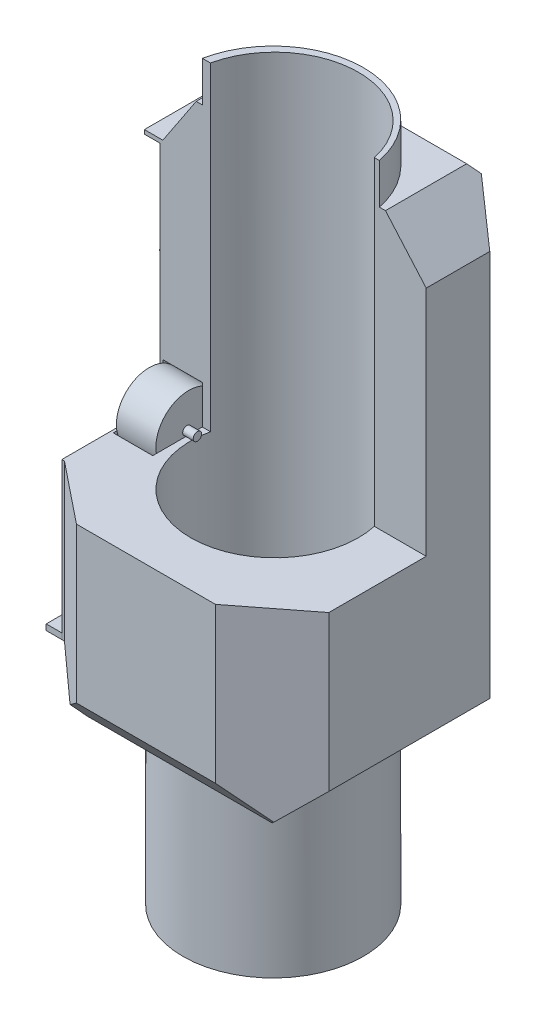
from build123d import *

# Parameters (mm, degrees)
SKETCH1_W            = 100
SKETCH1_H            = 100
BOSS_EXTRUDE1_DEPTH  = 180
SKETCH2_R            = 34.257790197
BOSS_EXTRUDE2_DEPTH  = 350
SKETCH3_W            = 152.006357392
SKETCH3_H            = 282.452416457
CUT_EXTRUDE2_DEPTH   = 400
CUT_EXTRUDE3_DEPTH   = 400
CUT_EXTRUDE4_DEPTH   = 400
CUT_EXTRUDE5_DEPTH   = 400
SKETCH7_W            = 160.159381639
SKETCH7_H            = 147.362276113
CUT_EXTRUDE6_DEPTH   = 400
SKETCH8_W            = 147.310744502
SKETCH8_H            = 162.038906966
CUT_EXTRUDE7_DEPTH   = 400
SKETCH9_R            = 31.847293423
CUT_EXTRUDE8_DEPTH   = 400
SKETCH10_W           = 140.220962397
SKETCH10_H           = 212.033531124
CUT_EXTRUDE9_DEPTH   = 400
SKETCH11_R           = 13.603137886
CUT_EXTRUDE11_DEPTH  = 15
SKETCH12_R           = 12.495422516
BOSS_EXTRUDE3_DEPTH  = 15
SKETCH13_R           = 1.594865099
BOSS_EXTRUDE4_DEPTH  = 4
SKETCH14_W           = 100.74862993
SKETCH14_H           = 110.555003588
CUT_EXTRUDE13_DEPTH  = 400
BOSS_EXTRUDE5_DEPTH  = 1
SKETCH16_W           = 24.504230724
SKETCH16_H           = 30.458347221
BOSS_EXTRUDE6_DEPTH  = 5
SKETCH17_W           = 18.669530869
SKETCH17_H           = 22.4027039
BOSS_EXTRUDE7_DEPTH  = 1
SKETCH18_W           = 4.907623399
SKETCH18_H           = 5.170746831
SKETCH18_W_2         = 3.981473695
SKETCH18_H_2         = 5.451349552
BOSS_EXTRUDE8_DEPTH  = 1
BOSS_EXTRUDE9_DEPTH  = 1
SKETCH21_W           = 16.281298494
SKETCH21_H           = 30.70477752
BOSS_EXTRUDE10_DEPTH = 5
SKETCH22_W           = 0.561666562
SKETCH22_H           = 0.603858724
SKETCH22_W_2         = 0.53443704
SKETCH22_W_3         = 0.536755884
SKETCH22_H_2         = 0.595744993
SKETCH22_W_4         = 0.555081497
SKETCH22_H_3         = 0.603543747
SKETCH22_H_4         = 0.606016701
SKETCH22_W_5         = 0.51195437
BOSS_EXTRUDE11_DEPTH = 1
BOSS_EXTRUDE12_DEPTH = 6
SKETCH25_W           = 2.05187696
SKETCH25_H           = 1.431834862
SKETCH25_W_2         = 1.796011721
SKETCH25_H_2         = 1.401423583
SKETCH25_W_3         = 2.236836814
SKETCH25_H_3         = 1.629424689
SKETCH25_W_4         = 3.100041403
SKETCH25_H_4         = 2.495375298
BOSS_EXTRUDE14_DEPTH = 1
SKETCH26_R           = 0.573723192
SKETCH26_R_2         = 0.465712851
SKETCH26_R_3         = 0.493763185
SKETCH26_R_4         = 0.521232976
SKETCH26_R_5         = 1.279348583
BOSS_EXTRUDE15_DEPTH = 3


with BuildPart() as part:
    # Sketch1 → Boss-Extrude1 (new body)
    with BuildSketch(Plane(origin=(0, 0, 0), x_dir=(1, 0, 0), z_dir=(0, 1, 0))):
        with Locations((-50, 50)):
            Rectangle(SKETCH1_W, SKETCH1_H)
    extrude(amount=BOSS_EXTRUDE1_DEPTH)

    # Sketch2 → Boss-Extrude2 (add, symmetric)
    with BuildSketch(Plane(origin=(0, 180, 0), x_dir=(1, 0, 0), z_dir=(0, 1, 0))):
        with Locations(Location((-51.377291833, 49.076536384, 0), (0, 0, 270))):
            Circle(SKETCH2_R)
    extrude(amount=BOSS_EXTRUDE2_DEPTH, both=True)

    # Sketch3 → Cut-Extrude2 (cut)
    with BuildSketch(Plane(origin=(0, 0, 0), x_dir=(0, 0, -1), z_dir=(1, 0, 0))):
        with Locations((57.419900112, 502.274302507)):
            Rectangle(SKETCH3_W, SKETCH3_H)
    extrude(amount=-CUT_EXTRUDE2_DEPTH, mode=Mode.SUBTRACT)

    # Sketch4 → Cut-Extrude3 (cut)
    with BuildSketch(Plane(origin=(0, 0, 0), x_dir=(0, 0, -1), z_dir=(1, 0, 0))):
        Polygon((12.981970869, 0), (-8.994244796, 25.828096003), (-18.564506014, -15.259465835), align=None)
        Polygon((85.072517936, -1.448103984), (109.237639161, 19.113145112), (115.920034239, -3.267382694), align=None)
        Polygon((12.981970869, 180), (-8.994244796, 148.537596011), (-15.418178585, 193.219274892), align=None)
        Polygon((85.072517936, 181.854312784), (103.841225373, 159.795920888), (106.132549481, 198.647393934), align=None)
    extrude(amount=-CUT_EXTRUDE3_DEPTH, mode=Mode.SUBTRACT)

    # Sketch5 → Cut-Extrude4 (cut)
    with BuildSketch(Plane.XY):
        Polygon((-85.623287335, 0), (-106.370377984, 21.426392531), (-122.288861874, 3.209259887), (-93.526345261, -19.884701759), align=None)
        Polygon((-15.694988751, 0), (0, 15.257385304), (12.122677088, 15.257385304), (10.563067769, -19.884701759), align=None)
        Polygon((-87.166490339, 180.248071029), (-106.370377984, 151.29108453), (-117.705469457, 200.501115102), align=None)
        Polygon((-15.694988751, 180.248071029), (7.833767065, 153.279557508), (0, 193.941208308), align=None)
    extrude(amount=-CUT_EXTRUDE4_DEPTH, mode=Mode.SUBTRACT)

    # Sketch6 → Cut-Extrude5 (cut)
    with BuildSketch(Plane(origin=(0, 180, 0), x_dir=(1, 0, 0), z_dir=(0, 1, 0))):
        Polygon((-112.386997555, 28.400400964), (-64.261264503, -10.212759359), (-84.406366528, -15.51192827), (-124.649689542, -15.51192827), align=None)
        Polygon((-97.065537028, 135.861756084), (-119.37552445, 77.792688888), (-118.043343626, 64.347606737), (-66.428694172, 110.575168787), align=None)
        Polygon((-24.69640689, -21.815840769), (11.092108798, -8.97361337), (17.428316417, 32.393768119), (-38.531576846, -11.139157378), align=None)
        Polygon((-17.445484601, 140.804394854), (35.417473102, 107.262520599), (9.305452855, 72.996438725), (-31.724385352, 103.625272537), align=None)
    extrude(amount=-CUT_EXTRUDE5_DEPTH, mode=Mode.SUBTRACT)

    # Sketch7 → Cut-Extrude6 (cut)
    with BuildSketch(Plane.XY):
        with Locations((-66.123258915, -136.36252694)):
            Rectangle(SKETCH7_W, SKETCH7_H)
    extrude(amount=-CUT_EXTRUDE6_DEPTH, mode=Mode.SUBTRACT)

    # Sketch8 → Cut-Extrude7 (cut)
    with BuildSketch(Plane.XY):
        with Locations((-53.541153336, 332.448287589)):
            Rectangle(SKETCH8_W, SKETCH8_H)
    extrude(amount=-CUT_EXTRUDE7_DEPTH, mode=Mode.SUBTRACT)

    # Sketch9 → Cut-Extrude8 (cut)
    with BuildSketch(Plane(origin=(0, 251.428834106, 0), x_dir=(1, 0, 0), z_dir=(0, 1, 0))):
        with Locations(Location((-50.808993157, 49.032036374, 0), (0, 0, 270))):
            Circle(SKETCH9_R)
    extrude(amount=-CUT_EXTRUDE8_DEPTH, mode=Mode.SUBTRACT)

    # Sketch10 → Cut-Extrude9 (cut)
    with BuildSketch(Plane.ZY.offset(100)):
        with Locations((14.299084536, 180.100625535)):
            Rectangle(SKETCH10_W, SKETCH10_H)
    extrude(amount=-CUT_EXTRUDE9_DEPTH, mode=Mode.SUBTRACT)

    # Sketch11 → Cut-Extrude11 (cut)
    with BuildSketch(Plane.ZY.offset(100)):
        with Locations((-50.413251954, 76.264646142)):
            Circle(SKETCH11_R)
    extrude(amount=-CUT_EXTRUDE11_DEPTH, mode=Mode.SUBTRACT)

    # Sketch12 → Boss-Extrude3 (add)
    with BuildSketch(Plane.ZY.offset(85)):
        with Locations(Location((-50.658800768, 76.222522328, 0), (0, 0, 114.353089558))):
            Circle(SKETCH12_R)
    extrude(amount=BOSS_EXTRUDE3_DEPTH)

    # Sketch13 → Boss-Extrude4 (add)
    with BuildSketch(Plane(origin=(-85, 0, 0), x_dir=(0, 0, -1), z_dir=(1, 0, 0))):
        with Locations(Location((49.945205578, 75.944780088, 0), (0, 0, 180))):
            Circle(SKETCH13_R)
    extrude(amount=BOSS_EXTRUDE4_DEPTH)

    # Sketch14 → Cut-Extrude13 (cut)
    with BuildSketch(Plane.ZY.offset(100)):
        with Locations((-65.350029467, 250.603414818)):
            Rectangle(SKETCH14_W, SKETCH14_H)
    extrude(amount=-CUT_EXTRUDE13_DEPTH, mode=Mode.SUBTRACT)

    # Sketch15 → Boss-Extrude5 (add)
    with BuildSketch(Plane.ZY.offset(100)):
        Polygon((-18.461827727, 14.847435435), (-80.507743362, 14.847435435), (-80.507743362, 160.896793159), (-55.811396663, 160.896793159), (-55.811396663, 74.083859973), (-18.461827727, 74.083859973), align=None)
    extrude(amount=BOSS_EXTRUDE5_DEPTH)

    # Sketch16 → Boss-Extrude6 (add)
    with BuildSketch(Plane.ZY.offset(101)):
        with Locations((-39.275145749, 45.136437142)):
            Rectangle(SKETCH16_W, SKETCH16_H)
    extrude(amount=BOSS_EXTRUDE6_DEPTH)

    # Sketch17 → Boss-Extrude7 (add)
    with BuildSketch(Plane.ZY.offset(101)):
        with Locations((-67.04663872, 130.409241603)):
            Rectangle(SKETCH17_W, SKETCH17_H)
    extrude(amount=BOSS_EXTRUDE7_DEPTH)

    # Sketch18 → Boss-Extrude8 (add)
    with BuildSketch(Plane.ZY.offset(102)):
        with Locations((-71.625108618, 130.213401885)):
            Rectangle(SKETCH18_W, SKETCH18_H)
        with Locations((-62.297675883, 129.867186512)):
            Rectangle(SKETCH18_W_2, SKETCH18_H_2)
    extrude(amount=BOSS_EXTRUDE8_DEPTH)

    # Sketch19 → Boss-Extrude9 (add)
    with BuildSketch(Plane.ZY.offset(102)):
        Polygon((-66.976455081, 134.868836652), (-73.7929295, 134.868836652), (-73.7929295, 134.108269479), (-74.571872104, 134.108269479), (-74.571872104, 140.512729543), (-73.7929295, 140.512729543), (-72.165965418, 140.512729543), (-72.233411796, 137.421948277), (-71.48458153, 137.421948277), (-71.410861795, 140.512729543), (-69.158339735, 140.504865112), (-69.158339735, 137.421948277), (-68.22174926, 137.421948277), (-68.22174926, 140.567922793), (-65.426885805, 140.567922793), (-65.515241968, 137.446210948), (-64.714122339, 137.446210948), (-64.714122339, 140.567922793), (-62.410871788, 140.567922793), (-62.410871788, 137.210126003), (-61.403493639, 137.210126003), (-61.403493639, 140.631129361), (-58.889974549, 140.631129361), (-58.889974549, 136.595539338), (-59.698319644, 136.595539338), (-59.698319644, 139.99489006), (-60.695848378, 139.984078324), (-60.695848378, 136.667717235), (-63.090112056, 136.667717235), (-63.090112056, 139.979723883), (-64.00479018, 139.979723883), (-64.00479018, 136.667717235), (-66.334605538, 136.667717235), (-66.334605538, 139.902697072), (-67.48995239, 139.902697072), (-67.48995239, 136.667717235), (-70.008746759, 136.667717235), (-70.008746759, 139.902697072), (-70.709698815, 139.902697072), (-70.783897489, 136.693128041), (-72.921241048, 136.693128041), (-72.921241048, 139.545601992), (-73.7929295, 139.545601992), (-73.7929295, 135.423339258), (-66.976455081, 135.49721976), align=None)
    extrude(amount=BOSS_EXTRUDE9_DEPTH)

    # Sketch21 → Boss-Extrude10 (add)
    with BuildSketch(Plane.ZY.offset(101)):
        with Locations((-60.112791098, 44.859291254)):
            Rectangle(SKETCH21_W, SKETCH21_H)
    extrude(amount=BOSS_EXTRUDE10_DEPTH)

    # Sketch22 → Boss-Extrude11 (add)
    with BuildSketch(Plane.ZY.offset(102)):
        with Locations((-60.80943011, 132.899150377)):
            Rectangle(SKETCH22_W, SKETCH22_H)
        with Locations((-61.69225831, 132.899150377)):
            Rectangle(SKETCH22_W_2, SKETCH22_H)
        with Locations((-62.62493976, 132.903207243)):
            Rectangle(SKETCH22_W_3, SKETCH22_H_2)
        with Locations((-63.54978292, 132.899150377)):
            Rectangle(SKETCH22_W_4, SKETCH22_H)
        with Locations((-60.80943011, 126.809637752)):
            Rectangle(SKETCH22_W, SKETCH22_H_3)
        with Locations((-61.69225831, 126.810874229)):
            Rectangle(SKETCH22_W_2, SKETCH22_H_4)
        with Locations((-62.612539003, 126.810874229)):
            Rectangle(SKETCH22_W_5, SKETCH22_H_4)
        with Locations((-63.54978292, 126.810874229)):
            Rectangle(SKETCH22_W_4, SKETCH22_H_4)
    extrude(amount=BOSS_EXTRUDE11_DEPTH)

    # Sketch23 → Boss-Extrude12 (add)
    with BuildSketch(Plane.ZY.offset(101)):
        Polygon((-18.537813866, 14.791366127), (-79.213766301, 14.791366127), (-80.507051433, 14.791366127), (-80.507051433, 159.371320923), (-80.507051433, 160.896793159), (-55.811396663, 160.896793159), (-55.811396663, 159.371320923), (-79.213766301, 159.371320923), (-79.213766301, 17.002342126), (-18.537813866, 17.002342126), align=None)
    extrude(amount=BOSS_EXTRUDE12_DEPTH)

    # Sketch25 → Boss-Extrude14 (add)
    with BuildSketch(Plane.ZY.offset(102)):
        with Locations((-61.129787429, 123.818208842)):
            Rectangle(SKETCH25_W, SKETCH25_H)
        with Locations((-65.19439703, 123.964756725)):
            Rectangle(SKETCH25_W_2, SKETCH25_H_2)
        with Locations((-68.910775783, 124.164887859)):
            Rectangle(SKETCH25_W_3, SKETCH25_H_3)
        with Locations((-66.785980271, 133.389843397)):
            Rectangle(SKETCH25_W_4, SKETCH25_H_4)
    extrude(amount=BOSS_EXTRUDE14_DEPTH)

    # Sketch26 → Boss-Extrude15 (add)
    with BuildSketch(Plane.ZY.offset(102)):
        with Locations(Location((-60.110646134, 120.378030712, 0), (0, 0, 180))):
            Circle(SKETCH26_R)
        with Locations(Location((-62.678722835, 120.378030712, 0), (0, 0, 180))):
            Circle(SKETCH26_R_2)
        with Locations(Location((-64.743607979, 120.378030712, 0), (0, 0, 180))):
            Circle(SKETCH26_R_3)
        with Locations(Location((-66.814452943, 120.378030712, 0), (0, 0, 180))):
            Circle(SKETCH26_R_4)
        with Locations(Location((-73.109350706, 124.443085331, 0), (0, 0, 180))):
            Circle(SKETCH26_R_5)
    extrude(amount=BOSS_EXTRUDE15_DEPTH)


solid = part.part
